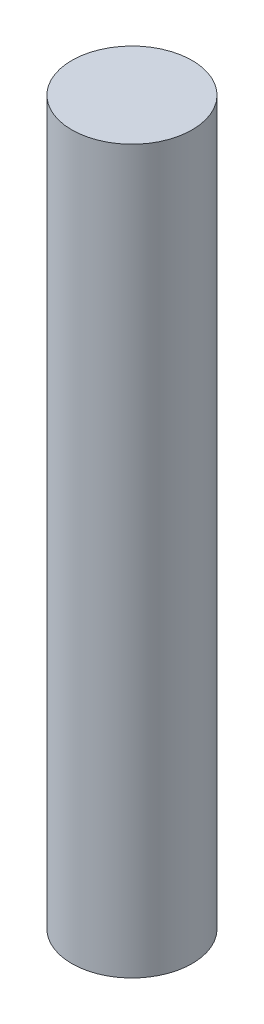
from build123d import *

# Parameters (mm, degrees)
SKETCH1_R           = 25
BOSS_EXTRUDE1_DEPTH = 300


with BuildPart() as part:
    # Sketch1 → Boss-Extrude1 (new body)
    with BuildSketch(Plane(origin=(0, 0, 0), x_dir=(1, 0, 0), z_dir=(0, 1, 0))):
        with Locations(Location((0, 0, 0), (0, 0, 270))):
            Circle(SKETCH1_R)
    extrude(amount=BOSS_EXTRUDE1_DEPTH)


solid = part.part
